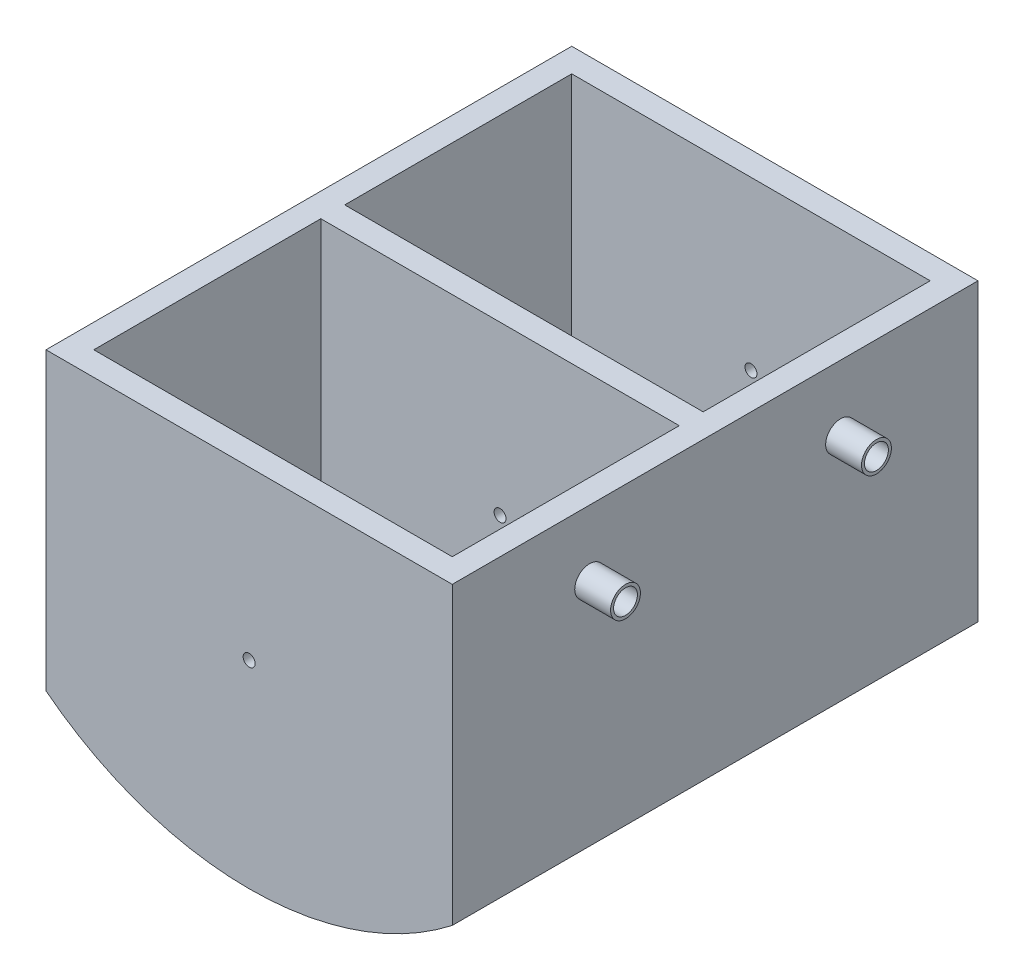
from build123d import *

# Parameters (mm, degrees)
SKETCH1_R           = 5
BOSS_EXTRUDE1_DEPTH = 440
CUT_EXTRUDE2_START  = -420
SKETCH2_R           = 5
CUT_EXTRUDE2_DEPTH  = 420
BOSS_EXTRUDE2_START = -20
SKETCH3_R           = 5
BOSS_EXTRUDE2_DEPTH = 20
BOSS_EXTRUDE3_START = -20
SKETCH4_R           = 5
BOSS_EXTRUDE3_DEPTH = 20
CUT_EXTRUDE3_DEPTH  = 190
CUT_EXTRUDE4_START  = 190
CUT_EXTRUDE4_DEPTH  = 190
SKETCH8_R           = 10
CUT_EXTRUDE5_DEPTH  = 190
BOSS_EXTRUDE4_START = 30
SKETCH9_R           = 12.5
SKETCH9_R_2         = 10
BOSS_EXTRUDE4_DEPTH = 30
BOSS_EXTRUDE5_DEPTH = 440


with BuildPart() as part:
    # Sketch1 → Boss-Extrude1 (new body)
    with BuildSketch(Plane.XY):
        with BuildLine():
            Line((-170, 140), (170, 140))
            Line((170, 140), (170, -100))
            ThreePointArc((170, -100), (0, -160), (-170, -100))
            Line((-170, -100), (-170, 140))
        make_face()
        Circle(SKETCH1_R, mode=Mode.SUBTRACT)
    extrude(amount=BOSS_EXTRUDE1_DEPTH)

    # Sketch2 → Cut-Extrude2 (cut)
    with BuildSketch(Plane.XY.offset(440).offset(CUT_EXTRUDE2_START)):
        with BuildLine():
            Line((150, 140), (-150, 140))
            Line((-150, 140), (-150, -90.207361828))
            ThreePointArc((-150, -90.207361828), (0, -140), (150, -90.207361828))
            Line((150, -90.207361828), (150, 140))
        make_face()
        Circle(SKETCH2_R, mode=Mode.SUBTRACT)
    extrude(amount=CUT_EXTRUDE2_DEPTH, mode=Mode.SUBTRACT)

    # Sketch3 → Boss-Extrude2 (add)
    with BuildSketch(Plane.XY.offset(440).offset(BOSS_EXTRUDE2_START)):
        with BuildLine():
            Line((-150, 140), (-150, -90.207361828))
            ThreePointArc((-150, -90.207361828), (0, -140), (150, -90.207361828))
            Line((150, -90.207361828), (150, 140))
            Line((150, 140), (-150, 140))
        make_face()
        Circle(SKETCH3_R, mode=Mode.SUBTRACT)
    extrude(amount=BOSS_EXTRUDE2_DEPTH)

    # Sketch4 → Boss-Extrude3 (add)
    with BuildSketch(Plane.XY.offset(230).offset(BOSS_EXTRUDE3_START)):
        with BuildLine():
            Line((-170, 140), (-170, -100))
            ThreePointArc((-170, -100), (0, -160), (170, -100))
            Line((170, -100), (170, 140))
            Line((170, 140), (-170, 140))
        make_face()
        Circle(SKETCH4_R, mode=Mode.SUBTRACT)
    extrude(amount=BOSS_EXTRUDE3_DEPTH)

    # Sketch6 → Cut-Extrude3 (cut)
    with BuildSketch(Plane.XY.offset(230)):
        with BuildLine():
            Line((-80, -157.872832651), (-80, -126.403399298))
            ThreePointArc((-80, -126.403399298), (0, -139.528938804), (80, -126.403399298))
            Line((80, -126.403399298), (80, -157.872832651))
            ThreePointArc((80, -157.872832651), (0, -169.528938804), (-80, -157.872832651))
        make_face()
    extrude(amount=CUT_EXTRUDE3_DEPTH, mode=Mode.SUBTRACT)

    # Sketch7 → Cut-Extrude4 (cut)
    with BuildSketch(Plane(origin=(0, 0, 210), x_dir=(-1, 0, 0), z_dir=(0, 0, -1)).offset(CUT_EXTRUDE4_START)):
        with BuildLine():
            Line((-80, -126.900469714), (-80, -160.673360289))
            ThreePointArc((-80, -160.673360289), (0, -172.214162118), (80, -160.673360289))
            Line((80, -160.673360289), (80, -126.900469714))
            ThreePointArc((80, -126.900469714), (0, -140), (-80, -126.900469714))
        make_face()
    extrude(amount=-CUT_EXTRUDE4_DEPTH, mode=Mode.SUBTRACT)

    # Sketch8 → Cut-Extrude5 (cut)
    with BuildSketch(Plane(origin=(170, 0, 0), x_dir=(0, 0, -1), z_dir=(1, 0, 0))):
        with Locations((-325, 85)):
            Circle(SKETCH8_R)
        with Locations((-115, 85)):
            Circle(SKETCH8_R)
    extrude(amount=-CUT_EXTRUDE5_DEPTH, mode=Mode.SUBTRACT)

    # Sketch9 → Boss-Extrude4 (add)
    # profile 1 of 2: a face of its own
    with BuildSketch(Plane(origin=(170, 0, 0), x_dir=(0, 0, -1), z_dir=(1, 0, 0)).offset(BOSS_EXTRUDE4_START)):
        with Locations(Location((-325, 85, 0), (0, 0, 180))):
            Circle(SKETCH9_R)
        with Locations((-325, 85)):
            Circle(SKETCH9_R_2, mode=Mode.SUBTRACT)
    # profile 2 of 2: a face of its own
    with BuildSketch(Plane(origin=(170, 0, 0), x_dir=(0, 0, -1), z_dir=(1, 0, 0)).offset(BOSS_EXTRUDE4_START)):
        with Locations(Location((-115, 85, 0), (0, 0, 180))):
            Circle(SKETCH9_R)
        with Locations((-115, 85)):
            Circle(SKETCH9_R_2, mode=Mode.SUBTRACT)
    extrude(amount=-BOSS_EXTRUDE4_DEPTH)

    # Sketch10 → Boss-Extrude5 (add)
    with BuildSketch(Plane(origin=(0, 0, 0), x_dir=(-1, 0, 0), z_dir=(0, 0, -1))):
        with BuildLine():
            Line((-170, -100), (-170, -107.237017076))
            ThreePointArc((-170, -107.237017076), (0, -165.671056736), (170, -107.237017076))
            Line((170, -107.237017076), (170, -100))
            ThreePointArc((170, -100), (0, -160), (-170, -100))
        make_face()
    extrude(amount=-BOSS_EXTRUDE5_DEPTH)


solid = part.part
